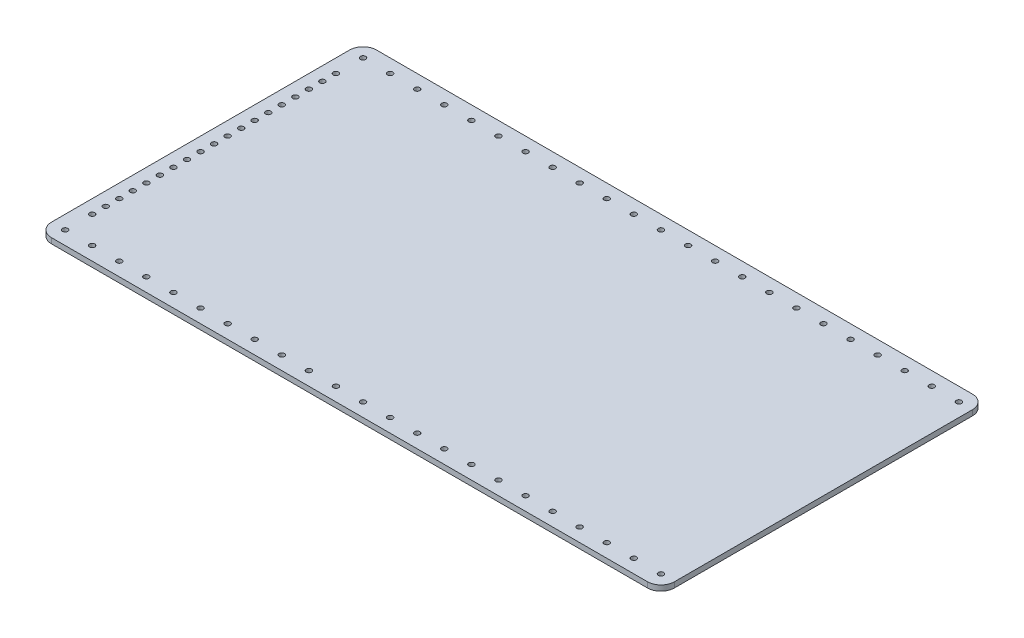
from build123d import *

# Parameters (mm, degrees)
SKETCH1_W           = 584.2
SKETCH1_H           = 304.8
BOSS_EXTRUDE1_DEPTH = 5.08
SKETCH3_R           = 2.4892
CUT_EXTRUDE1_DEPTH  = 659.95256764
FILLET1_R           = 12.7


with BuildPart() as part:
    # Sketch1 → Boss-Extrude1 (new body)
    with BuildSketch(Plane(origin=(0, 0, 0), x_dir=(1, 0, 0), z_dir=(0, 1, 0))):
        with Locations((292.1, 152.4)):
            Rectangle(SKETCH1_W, SKETCH1_H)
    extrude(amount=BOSS_EXTRUDE1_DEPTH)

    # Sketch3 → Cut-Extrude1 (cut, through all)
    with BuildSketch(Plane(origin=(0, 5.08, 0), x_dir=(1, 0, 0), z_dir=(0, 1, 0))):
        with Locations(Location((12.7, 292.1, 0), (0, 0, 270))):
            Circle(SKETCH3_R)
        with Locations(Location((38.1, 292.1, 0), (0, 0, 270))):
            Circle(SKETCH3_R)
        with Locations(Location((63.5, 292.1, 0), (0, 0, 270))):
            Circle(SKETCH3_R)
        with Locations(Location((88.9, 292.1, 0), (0, 0, 270))):
            Circle(SKETCH3_R)
        with Locations(Location((114.3, 292.1, 0), (0, 0, 270))):
            Circle(SKETCH3_R)
        with Locations(Location((139.7, 292.1, 0), (0, 0, 270))):
            Circle(SKETCH3_R)
        with Locations(Location((165.1, 292.1, 0), (0, 0, 270))):
            Circle(SKETCH3_R)
        with Locations(Location((190.5, 292.1, 0), (0, 0, 270))):
            Circle(SKETCH3_R)
        with Locations(Location((215.9, 292.1, 0), (0, 0, 270))):
            Circle(SKETCH3_R)
        with Locations(Location((241.3, 292.1, 0), (0, 0, 270))):
            Circle(SKETCH3_R)
        with Locations(Location((266.7, 292.1, 0), (0, 0, 270))):
            Circle(SKETCH3_R)
        with Locations(Location((292.1, 292.1, 0), (0, 0, 270))):
            Circle(SKETCH3_R)
        with Locations(Location((317.5, 292.1, 0), (0, 0, 270))):
            Circle(SKETCH3_R)
        with Locations(Location((342.9, 292.1, 0), (0, 0, 270))):
            Circle(SKETCH3_R)
        with Locations(Location((368.3, 292.1, 0), (0, 0, 270))):
            Circle(SKETCH3_R)
        with Locations(Location((393.7, 292.1, 0), (0, 0, 270))):
            Circle(SKETCH3_R)
        with Locations(Location((419.1, 292.1, 0), (0, 0, 270))):
            Circle(SKETCH3_R)
        with Locations(Location((444.5, 292.1, 0), (0, 0, 270))):
            Circle(SKETCH3_R)
        with Locations(Location((469.9, 292.1, 0), (0, 0, 270))):
            Circle(SKETCH3_R)
        with Locations(Location((495.3, 292.1, 0), (0, 0, 270))):
            Circle(SKETCH3_R)
        with Locations(Location((520.7, 292.1, 0), (0, 0, 270))):
            Circle(SKETCH3_R)
        with Locations(Location((546.1, 292.1, 0), (0, 0, 270))):
            Circle(SKETCH3_R)
        with Locations(Location((571.5, 292.1, 0), (0, 0, 270))):
            Circle(SKETCH3_R)
        with Locations(Location((12.7, 266.7, 0), (0, 0, 270))):
            Circle(SKETCH3_R)
        with Locations(Location((12.7, 241.3, 0), (0, 0, 270))):
            Circle(SKETCH3_R)
        with Locations(Location((12.7, 215.9, 0), (0, 0, 270))):
            Circle(SKETCH3_R)
        with Locations(Location((12.7, 190.5, 0), (0, 0, 270))):
            Circle(SKETCH3_R)
        with Locations(Location((12.7, 165.1, 0), (0, 0, 270))):
            Circle(SKETCH3_R)
        with Locations(Location((12.7, 139.7, 0), (0, 0, 270))):
            Circle(SKETCH3_R)
        with Locations(Location((12.7, 114.3, 0), (0, 0, 270))):
            Circle(SKETCH3_R)
        with Locations(Location((12.7, 88.9, 0), (0, 0, 270))):
            Circle(SKETCH3_R)
        with Locations(Location((12.7, 63.5, 0), (0, 0, 270))):
            Circle(SKETCH3_R)
        with Locations(Location((12.7, 38.1, 0), (0, 0, 270))):
            Circle(SKETCH3_R)
        with Locations(Location((12.7, 12.7, 0), (0, 0, 270))):
            Circle(SKETCH3_R)
        with Locations(Location((38.1, 12.7, 0), (0, 0, 270))):
            Circle(SKETCH3_R)
        with Locations(Location((63.5, 12.7, 0), (0, 0, 270))):
            Circle(SKETCH3_R)
        with Locations(Location((88.9, 12.7, 0), (0, 0, 270))):
            Circle(SKETCH3_R)
        with Locations(Location((114.3, 12.7, 0), (0, 0, 270))):
            Circle(SKETCH3_R)
        with Locations(Location((139.7, 12.7, 0), (0, 0, 270))):
            Circle(SKETCH3_R)
        with Locations(Location((165.1, 12.7, 0), (0, 0, 270))):
            Circle(SKETCH3_R)
        with Locations(Location((190.5, 12.7, 0), (0, 0, 270))):
            Circle(SKETCH3_R)
        with Locations(Location((215.9, 12.7, 0), (0, 0, 270))):
            Circle(SKETCH3_R)
        with Locations(Location((241.3, 12.7, 0), (0, 0, 270))):
            Circle(SKETCH3_R)
        with Locations(Location((266.7, 12.7, 0), (0, 0, 270))):
            Circle(SKETCH3_R)
        with Locations(Location((292.1, 12.7, 0), (0, 0, 270))):
            Circle(SKETCH3_R)
        with Locations(Location((317.5, 12.7, 0), (0, 0, 270))):
            Circle(SKETCH3_R)
        with Locations(Location((342.9, 12.7, 0), (0, 0, 270))):
            Circle(SKETCH3_R)
        with Locations(Location((368.3, 12.7, 0), (0, 0, 270))):
            Circle(SKETCH3_R)
        with Locations(Location((393.7, 12.7, 0), (0, 0, 270))):
            Circle(SKETCH3_R)
        with Locations(Location((419.1, 12.7, 0), (0, 0, 270))):
            Circle(SKETCH3_R)
        with Locations(Location((444.5, 12.7, 0), (0, 0, 270))):
            Circle(SKETCH3_R)
        with Locations(Location((469.9, 12.7, 0), (0, 0, 270))):
            Circle(SKETCH3_R)
        with Locations(Location((495.3, 12.7, 0), (0, 0, 270))):
            Circle(SKETCH3_R)
        with Locations(Location((520.7, 12.7, 0), (0, 0, 270))):
            Circle(SKETCH3_R)
        with Locations(Location((546.1, 12.7, 0), (0, 0, 270))):
            Circle(SKETCH3_R)
        with Locations(Location((571.5, 12.7, 0), (0, 0, 270))):
            Circle(SKETCH3_R)
        with Locations(Location((12.7, 254, 0), (0, 0, 270))):
            Circle(SKETCH3_R)
        with Locations(Location((12.7, 228.6, 0), (0, 0, 270))):
            Circle(SKETCH3_R)
        with Locations(Location((12.7, 203.2, 0), (0, 0, 270))):
            Circle(SKETCH3_R)
        with Locations(Location((12.7, 177.8, 0), (0, 0, 270))):
            Circle(SKETCH3_R)
        with Locations(Location((12.7, 152.4, 0), (0, 0, 270))):
            Circle(SKETCH3_R)
        with Locations(Location((12.7, 127, 0), (0, 0, 270))):
            Circle(SKETCH3_R)
        with Locations(Location((12.7, 101.6, 0), (0, 0, 270))):
            Circle(SKETCH3_R)
        with Locations(Location((12.7, 76.2, 0), (0, 0, 270))):
            Circle(SKETCH3_R)
        with Locations(Location((12.7, 50.8, 0), (0, 0, 270))):
            Circle(SKETCH3_R)
    extrude(amount=-CUT_EXTRUDE1_DEPTH, mode=Mode.SUBTRACT)

    # Fillet1
    fillet1_edges = [part.edges().sort_by_distance(p)[0] for p in [
        (0, 2.54, -304.8),
        (584.2, 2.54, -304.8),
        (584.2, 2.54, 0),
        (0, 2.54, 0),
    ]]
    fillet(fillet1_edges, radius=FILLET1_R)


solid = part.part
